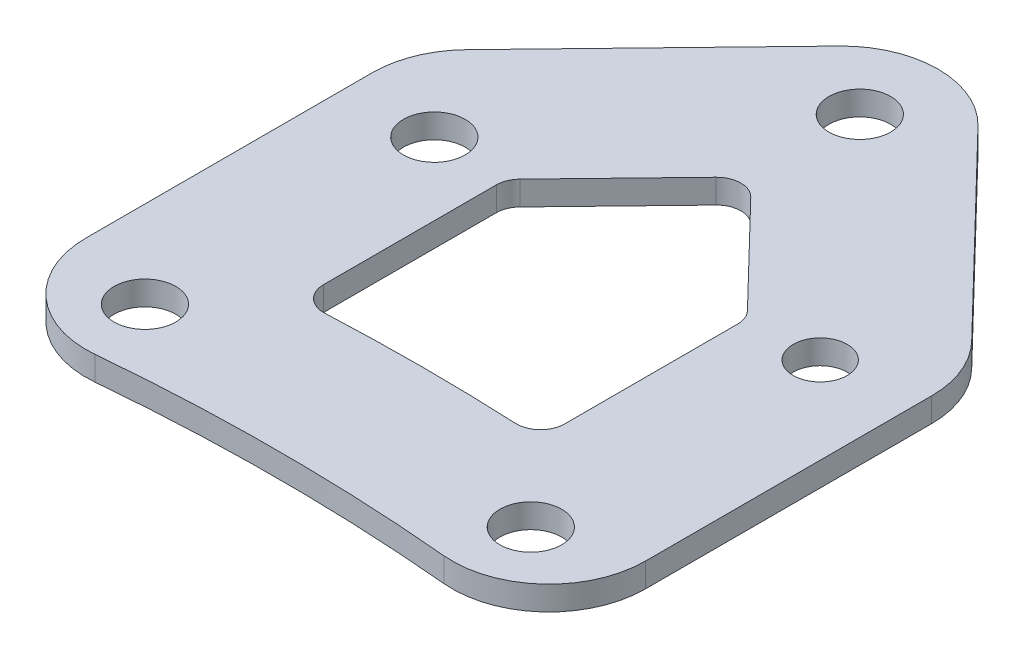
from build123d import *

# Parameters (mm, degrees)
BOSS_EXTRUDE1_DEPTH = 1.5875
SKETCH3_R           = 2.032
SKETCH3_R_2         = 1.778
CUT_EXTRUDE1_DEPTH  = 52.085937461
CUT_EXTRUDE2_DEPTH  = 52.085937461
FILLET1_R           = 6.35
FILLET2_R           = 1.5875


with BuildPart() as part:
    # Sketch1 → Boss-Extrude1 (new body)
    with BuildSketch(Plane(origin=(0, 0, 0), x_dir=(1, 0, 0), z_dir=(0, 1, 0))):
        with BuildLine():
            Line((0, 0), (18.415, -19.05))
            Line((18.415, -19.05), (18.415, -47.625))
            ThreePointArc((18.415, -47.625), (0, -46.266231115), (-18.415, -47.625))
            Line((-18.415, -47.625), (-18.415, -19.05))
            Line((-18.415, -19.05), (0, 0))
        make_face()
    extrude(amount=BOSS_EXTRUDE1_DEPTH)

    # Sketch3 → Cut-Extrude1 (cut, through all)
    with BuildSketch(Plane(origin=(0, 1.5875, 0), x_dir=(1, 0, 0), z_dir=(0, 1, 0))):
        with Locations(Location((12.7, -42.294109534, 0), (0, 0, 270))):
            Circle(SKETCH3_R)
        with Locations(Location((-12.7, -42.294109534, 0), (0, 0, 270))):
            Circle(SKETCH3_R)
        with Locations(Location((-12.7, -23.244109534, 0), (0, 0, 270))):
            Circle(SKETCH3_R)
        with Locations(Location((12.7, -23.244109534, 0), (0, 0, 270))):
            Circle(SKETCH3_R_2)
        with Locations(Location((0, -7.9375, 0), (0, 0, 270))):
            Circle(SKETCH3_R)
    extrude(amount=-CUT_EXTRUDE1_DEPTH, mode=Mode.SUBTRACT)

    # Sketch4 → Cut-Extrude2 (cut, through all)
    with BuildSketch(Plane(origin=(0, 1.5875, 0), x_dir=(1, 0, 0), z_dir=(0, 1, 0))):
        with BuildLine():
            Line((7.9375, -36.974796609), (7.9375, -23.286267168))
            Line((7.9375, -23.286267168), (0, -15.075060272))
            Line((0, -15.075060272), (-7.9375, -23.286267168))
            Line((-7.9375, -23.286267168), (-7.9375, -36.974796609))
            ThreePointArc((-7.9375, -36.974796609), (0, -36.741231115), (7.9375, -36.974796609))
        make_face()
    extrude(amount=-CUT_EXTRUDE2_DEPTH, mode=Mode.SUBTRACT)

    # Fillet1
    fillet1_edges = [part.edges().sort_by_distance(p)[0] for p in [
        (0, 0.79375, 0),
        (18.415, 0.79375, 19.05),
        (18.415, 0.79375, 47.625),
        (-18.415, 0.79375, 47.625),
        (-18.415, 0.79375, 19.05),
    ]]
    fillet(fillet1_edges, radius=FILLET1_R)

    # Fillet2
    fillet2_edges = [part.edges().sort_by_distance(p)[0] for p in [
        (-7.9375, 0.79375, 23.286267168),
        (0, 0.79375, 15.075060272),
        (7.9375, 0.79375, 23.286267168),
        (7.9375, 0.79375, 36.974796609),
        (-7.9375, 0.79375, 36.974796609),
    ]]
    fillet(fillet2_edges, radius=FILLET2_R)


solid = part.part
